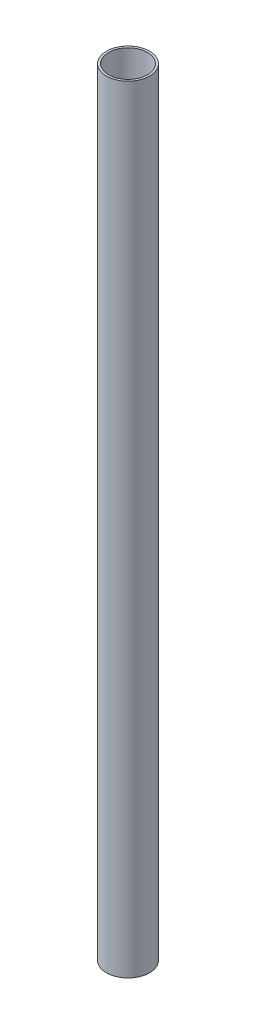
from build123d import *

# Parameters (mm, degrees)
SKETCH_1_R   = 10
SKETCH_1_R_2 = 9
F_1MM_DEPTH  = 180


with BuildPart() as part:
    # 草图1 → 1mm (new, symmetric)
    with BuildSketch(Plane(origin=(0, 0, 0), x_dir=(1, 0, 0), z_dir=(0, 1, 0))):
        Circle(SKETCH_1_R)
        Circle(SKETCH_1_R_2, mode=Mode.SUBTRACT)
    extrude(amount=F_1MM_DEPTH, both=True)


solid = part.part
